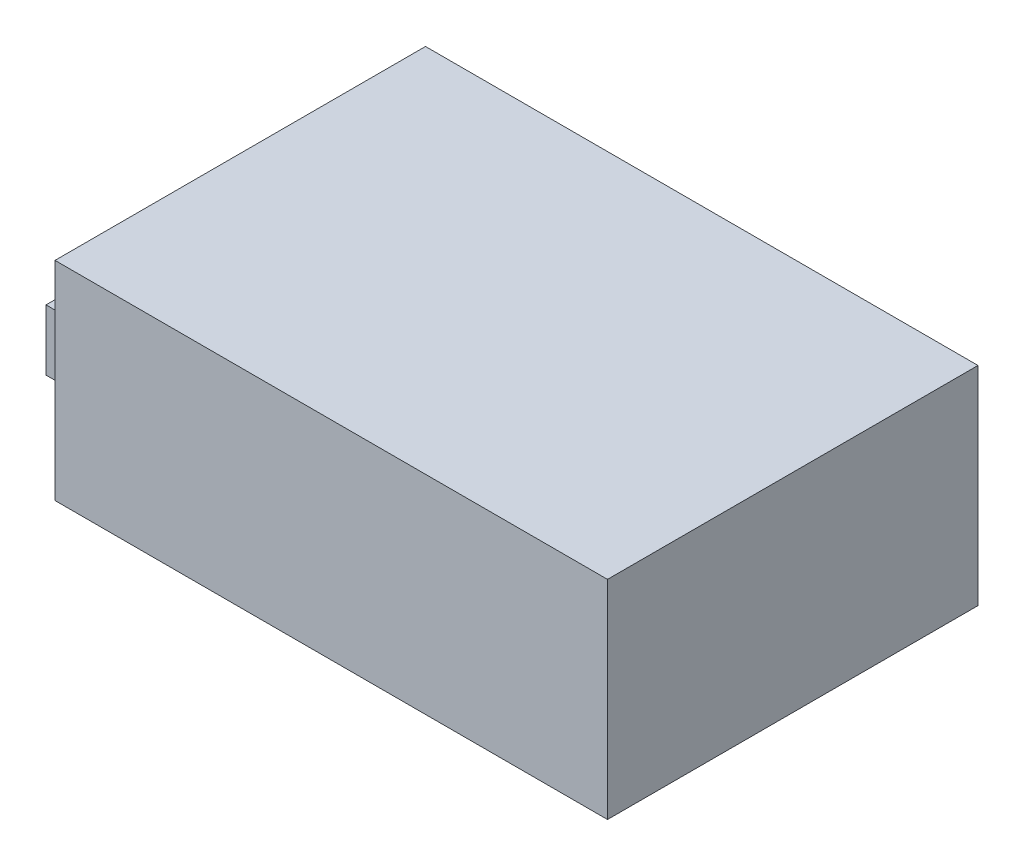
from build123d import *

# Parameters (mm, degrees)
SKETCH_1_W      = 85
SKETCH_1_H      = 57
EXTRUDE_1_DEPTH = 32
SKETCH_6_W      = 36.55514342
SKETCH_6_H      = 9.362324501
EXTRUDE_2_DEPTH = 14


with BuildPart() as part:
    # Эскиз1 → Бобышка-Вытянуть1 (new body)
    with BuildSketch(Plane(origin=(0, 0, 0), x_dir=(1, 0, 0), z_dir=(0, 1, 0))):
        Rectangle(SKETCH_1_W, SKETCH_1_H)
    extrude(amount=EXTRUDE_1_DEPTH)

    # Эскиз6 → Бобышка-Вытянуть2 (add)
    with BuildSketch(Plane.ZY.offset(42.5)):
        with Locations((-2.393178454, 8.082800526)):
            Rectangle(SKETCH_6_W, SKETCH_6_H)
    extrude(amount=EXTRUDE_2_DEPTH)


solid = part.part
